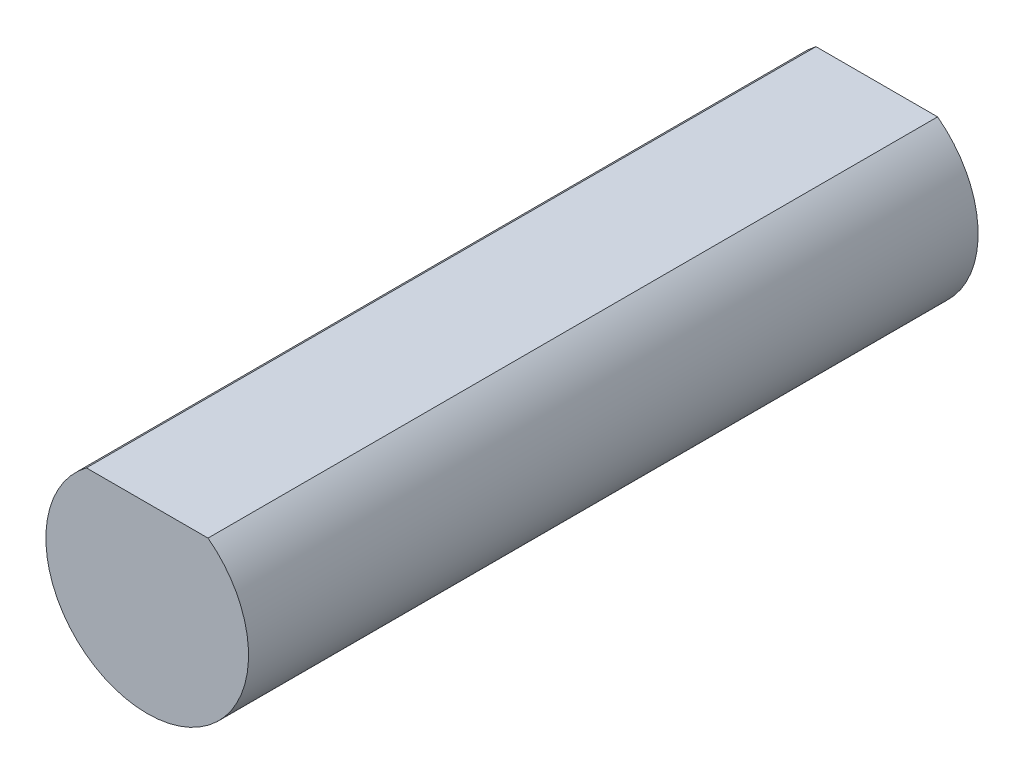
from build123d import *

# Parameters (mm, degrees)
EXTRUDE_1_DEPTH = 18


with BuildPart() as part:
    # 草图1 → 凸台-拉伸1 (new body)
    with BuildSketch(Plane.XY):
        with BuildLine():
            Line((1.5, 2), (-1.5, 2))
            ThreePointArc((-1.5, 2), (-1.118033989, -2.236067977), (2.5, 0))
            ThreePointArc((2.5, 0), (2.236067977, 1.118033989), (1.5, 2))
        make_face()
    extrude(amount=EXTRUDE_1_DEPTH)


solid = part.part
